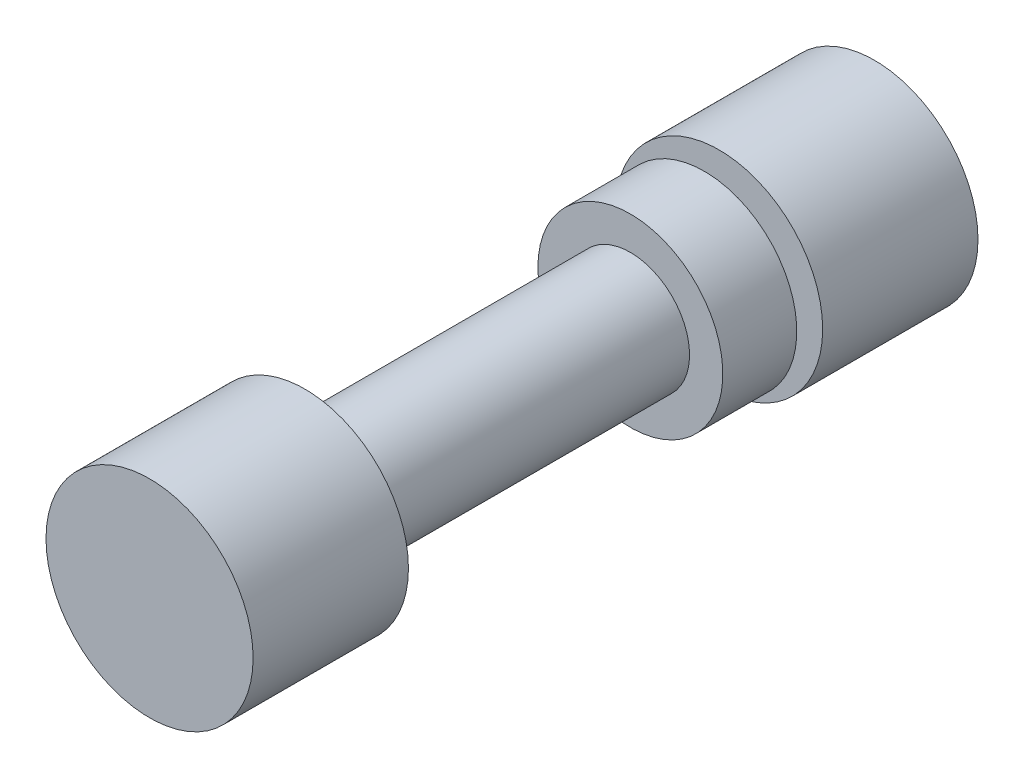
from build123d import *

# Parameters (mm, degrees)
ESQUISSE1_R        = 1.4
BOSS_EXTRU_1_DEPTH = 2.1
ESQUISSE2_R        = 0.8
BOSS_EXTRU_2_DEPTH = 5.6
ESQUISSE3_R        = 1.4
BOSS_EXTRU_3_DEPTH = 2.1
BOSS_EXTRU_4_START = -2.3
ESQUISSE4_R        = 1.25
BOSS_EXTRU_4_DEPTH = 1


with BuildPart() as part:
    # Esquisse1 → Boss.-Extru.1 (new body)
    with BuildSketch(Plane.XY):
        with Locations((4, 14.075)):
            Circle(ESQUISSE1_R)
    extrude(amount=BOSS_EXTRU_1_DEPTH)

    # Esquisse2 → Boss.-Extru.2 (add)
    with BuildSketch(Plane.XY.offset(2.1)):
        with Locations((4, 14.075)):
            Circle(ESQUISSE2_R)
    extrude(amount=BOSS_EXTRU_2_DEPTH)

    # Esquisse3 → Boss.-Extru.3 (add)
    with BuildSketch(Plane.XY.offset(7.7)):
        with Locations((4, 14.075)):
            Circle(ESQUISSE3_R)
    extrude(amount=BOSS_EXTRU_3_DEPTH)

    # Esquisse4 → Boss.-Extru.4 (add)
    with BuildSketch(Plane(origin=(0, 0, 0), x_dir=(-1, 0, 0), z_dir=(0, 0, -1)).offset(BOSS_EXTRU_4_START)):
        with Locations((-4, 14.075)):
            Circle(ESQUISSE4_R)
    extrude(amount=-BOSS_EXTRU_4_DEPTH)


solid = part.part
